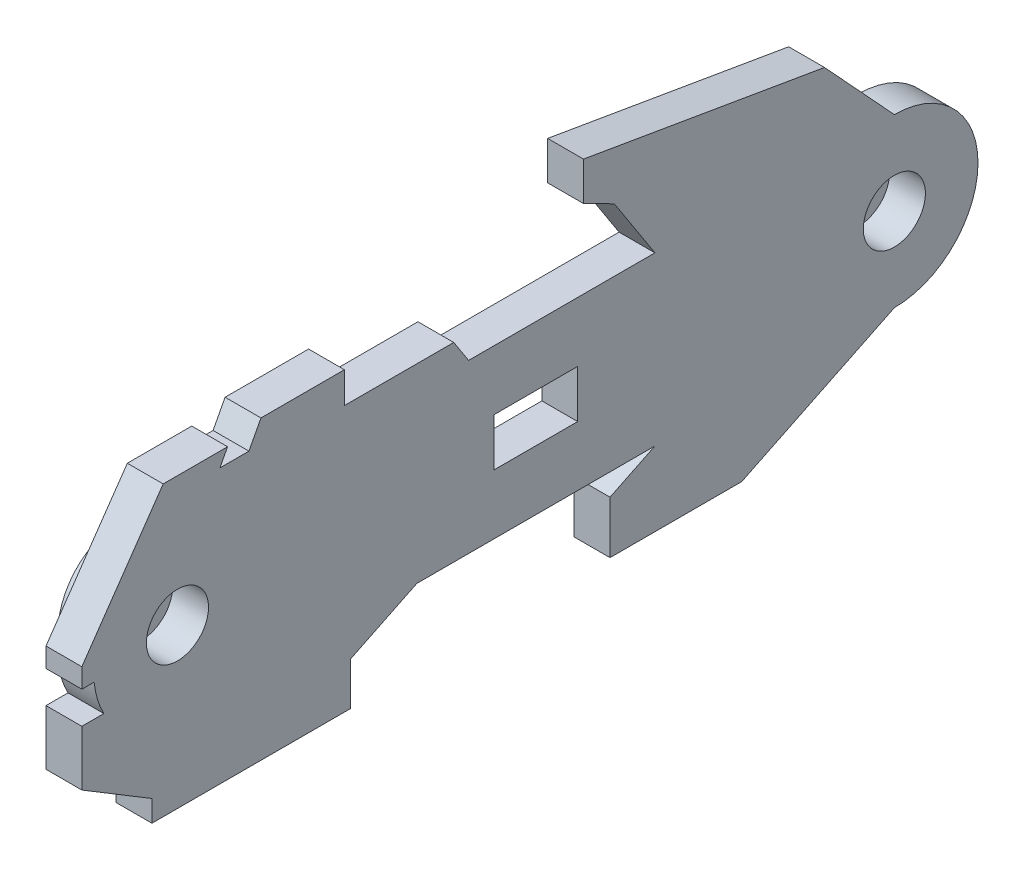
from build123d import *

# Parameters (mm, degrees)
BOSS_EXTRUDE1_DEPTH      = 7
BOSS_EXTRUDE1_DEPTH_BACK = 7
SKETCH3_R                = 7
BOSS_EXTRUDE2_DEPTH      = 3
CUT_EXTRUDE1_DEPTH       = 23
CUT_EXTRUDE1_DEPTH_BACK  = 23
SKETCH4_R                = 2.6
BOSS_EXTRUDE3_DEPTH      = 3
CUT_EXTRUDE2_DEPTH       = 20
CUT_EXTRUDE2_DEPTH_BACK  = 30
SKETCH6_W                = 36.146068324
SKETCH6_H                = 79.881394618
SKETCH7_W                = 6
SKETCH7_H                = 2
BOSS_EXTRUDE4_DEPTH      = 25
SKETCH8_R                = 1.5
CUT_EXTRUDE3_DEPTH       = 23
SKETCH9_W                = 6
SKETCH9_H                = 2
BOSS_EXTRUDE5_DEPTH      = 11
SKETCH10_W               = 10.612588882
SKETCH10_H               = 43.057143259
CUT_EXTRUDE4_DEPTH       = 10
CUT_EXTRUDE5_DEPTH       = 22
BOSS_EXTRUDE6_DEPTH      = 1.5
SKETCH17_W               = 50
SKETCH17_H               = 12
CUT_EXTRUDE7_DEPTH       = 22
SKETCH18_W               = 7
SKETCH18_H               = 4
CUT_EXTRUDE8_DEPTH       = 22


with BuildPart() as part:
    # Sketch2 → Boss-Extrude1 (new, two sides: drawn at the far end of the back side and taken through both)
    with BuildSketch(Plane(origin=(0, 0, 0), x_dir=(1, 0, 0), z_dir=(0, 1, 0)).offset(-BOSS_EXTRUDE1_DEPTH_BACK)):
        Polygon((12, 30), (12, -30), (9, -30), (9, -1.5), (-9, -1.5), (-9, -30), (-12, -30), (-12, 30), (-9, 30), (-9, 1.5), (9, 1.5), (9, 30), align=None)
    extrude(amount=BOSS_EXTRUDE1_DEPTH + BOSS_EXTRUDE1_DEPTH_BACK)

    # Sketch3 → Boss-Extrude2 (add)
    with BuildSketch(Plane(origin=(12, 0, 0), x_dir=(0, 0, -1), z_dir=(1, 0, 0))):
        with Locations((-30, 0)):
            Circle(SKETCH3_R)
        with Locations((30, 0)):
            Circle(SKETCH3_R)
    boss_extrude2 = extrude(amount=-BOSS_EXTRUDE2_DEPTH)

    # Mirror1: Boss-Extrude2 across plane
    add(boss_extrude2.mirror(Plane.ZY))

    # Sketch4 → Cut-Extrude1 (cut, two sides: drawn at the far end of the back side and taken through both)
    with BuildSketch(Plane.ZY.offset(-CUT_EXTRUDE1_DEPTH_BACK)):
        with Locations((-30, 0)):
            Circle(SKETCH4_R)
        with Locations((30, 0)):
            Circle(SKETCH4_R)
    extrude(amount=CUT_EXTRUDE1_DEPTH + CUT_EXTRUDE1_DEPTH_BACK, mode=Mode.SUBTRACT)

    # Sketch5 → Boss-Extrude3 (add)
    with BuildSketch(Plane.ZY.offset(12)):
        Polygon((-30, 7), (-24.155374342, 13.339180653), (-3.984430585, 16.782248387), (-3.984430585, 13.558363221), (-6.564031008, 12.252853794), (-9.961076462, 7), align=None)
        Polygon((5.630173652, 7), (6.872920148, 8.921659787), (16.024340395, 8.921659787), (16.024340395, 11.520201473), (23.010764714, 11.520201473), (24.017423371, 9.614604237), (26.442728945, 9.614604237), (25.802127981, 10.827257024), (33.625376893, 10.827257024), (39.584451678, 2.208760433), (39.584451678, -0.649635421), (35.450408088, -0.649635421), (35.450408088, 3.248177107), (30.561687085, 6.409736158), (5.630173652, 6.409736158), align=None)
        Polygon((-30, -7), (-17.229678236, -13.21512033), (-6.200995871, -13.21512033), (-6.200995871, -8.829973728), (-9.961076462, -7), align=None)
        Polygon((9.961076462, -7), (15.524820582, -9.707789187), (15.524820582, -13.295871625), (32.135298846, -13.295871625), (32.135298846, -11.501830406), (39.584451678, -7), (39.584451678, -3.334795163), (35.450408088, -3.334795163), (31.744983073, -5.574136385), (9.961076462, -5.574136385), align=None)
    boss_extrude3 = extrude(amount=-BOSS_EXTRUDE3_DEPTH)

    # Mirror2: Boss-Extrude3 across plane
    add(boss_extrude3.mirror(Plane.ZY))

    # Sketch6 → Cut-Extrude2 (cut, two sides: drawn at the far end of the back side and taken through both)
    with BuildSketch(Plane(origin=(0, 7, 0), x_dir=(1, 0, 0), z_dir=(0, 1, 0)).offset(-CUT_EXTRUDE2_DEPTH_BACK)):
        with Locations((9.073034162, -2.940697309)):
            Rectangle(SKETCH6_W, SKETCH6_H)
    extrude(amount=CUT_EXTRUDE2_DEPTH + CUT_EXTRUDE2_DEPTH_BACK, mode=Mode.SUBTRACT)

    # Sketch7 → Boss-Extrude4 (add)
    with BuildSketch(Plane(origin=(-9, 0, 0), x_dir=(0, 0, -1), z_dir=(1, 0, 0))):
        Rectangle(SKETCH7_W, SKETCH7_H)
    extrude(amount=BOSS_EXTRUDE4_DEPTH)

    # Sketch8 → Cut-Extrude3 (cut)
    with BuildSketch(Plane(origin=(0, 1, 0), x_dir=(1, 0, 0), z_dir=(0, 1, 0))):
        with Locations((13, 0)):
            Circle(SKETCH8_R)
        with Locations((5, 0)):
            Circle(SKETCH8_R)
    extrude(amount=-CUT_EXTRUDE3_DEPTH, mode=Mode.SUBTRACT)

    # Sketch9 → Boss-Extrude5 (add)
    with BuildSketch(Plane(origin=(-9, 0, 0), x_dir=(0, 0, -1), z_dir=(1, 0, 0))):
        with Locations((0, -2)):
            Rectangle(SKETCH9_W, SKETCH9_H)
    extrude(amount=BOSS_EXTRUDE5_DEPTH)

    # Sketch10 → Cut-Extrude4 (cut)
    with BuildSketch(Plane(origin=(-9, 0, 0), x_dir=(0, 0, -1), z_dir=(1, 0, 0))):
        with Locations((-43.306294441, -0.681634791)):
            Rectangle(SKETCH10_W, SKETCH10_H)
    extrude(amount=-CUT_EXTRUDE4_DEPTH, mode=Mode.SUBTRACT)

    # Sketch11 → Cut-Extrude5 (cut)
    with BuildSketch(Plane.ZY):
        Polygon((39.991694919, -1.896890181), (29.115063305, 13.833775376), (39.991694919, 13.833775376), align=None)
    extrude(amount=CUT_EXTRUDE5_DEPTH, mode=Mode.SUBTRACT)

    # Sketch12 → Boss-Extrude6 (add)
    with BuildSketch(Plane.ZY.offset(12)):
        with BuildLine():
            Line((-29.251939175, 5.448890254), (-13.9, 4.4))
            ThreePointArc((-13.9, 4.4), (-9.5, 0), (-13.9, -4.4))
            Line((-13.9, -4.4), (-29.251939175, -5.448890254))
            ThreePointArc((-29.251939175, -5.448890254), (-35.5, 0), (-29.251939175, 5.448890254))
        make_face()
        with BuildLine():
            Line((29.251939175, -5.448890254), (13.9, -4.4))
            ThreePointArc((13.9, -4.4), (9.5, 0), (13.9, 4.4))
            Line((13.9, 4.4), (29.251939175, 5.448890254))
            ThreePointArc((29.251939175, 5.448890254), (35.5, 0), (29.251939175, -5.448890254))
        make_face()
    extrude(amount=BOSS_EXTRUDE6_DEPTH)

    # Sketch17 → Cut-Extrude7 (cut)
    with BuildSketch(Plane(origin=(0, 1, 0), x_dir=(1, 0, 0), z_dir=(0, 1, 0))):
        with Locations((16, 3)):
            Rectangle(SKETCH17_W, SKETCH17_H)
    extrude(amount=-CUT_EXTRUDE7_DEPTH, mode=Mode.SUBTRACT)

    # Sketch18 → Cut-Extrude8 (cut)
    with BuildSketch(Plane(origin=(-9, 0, 0), x_dir=(0, 0, -1), z_dir=(1, 0, 0))):
        Rectangle(SKETCH18_W, SKETCH18_H)
    extrude(amount=-CUT_EXTRUDE8_DEPTH, mode=Mode.SUBTRACT)


solid = part.part
